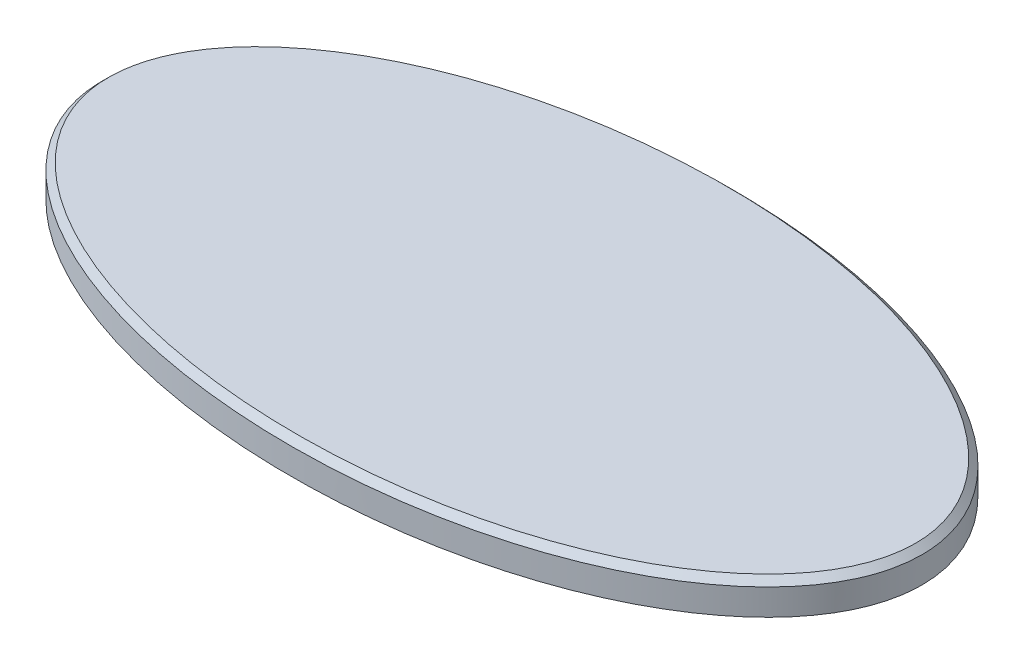
from build123d import *

# Parameters (mm, degrees)
SKETCH1_RX          = 125
SKETCH1_RY          = 67.5
BOSS_EXTRUDE1_DEPTH = 10
CHAMFER1_SIZE       = 2


with BuildPart() as part:
    # Sketch1 → Boss-Extrude1 (new body)
    with BuildSketch(Plane(origin=(0, 0, 0), x_dir=(1, 0, 0), z_dir=(0, 1, 0))):
        with Locations((0, 0)):
            Ellipse(SKETCH1_RX, SKETCH1_RY)
    extrude(amount=BOSS_EXTRUDE1_DEPTH)

    # Chamfer1
    chamfer1_edges = [part.edges().sort_by_distance(p)[0] for p in [
        (-124.99885436, 10, 0.288992647),
    ]]
    chamfer(chamfer1_edges, length=CHAMFER1_SIZE)


solid = part.part
